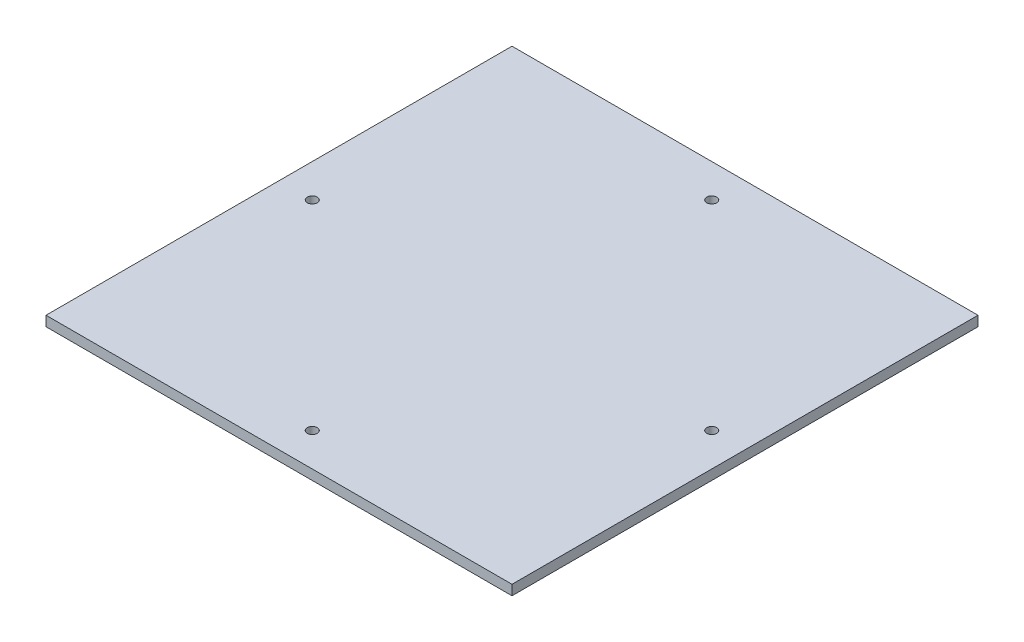
from build123d import *

# Parameters (mm, degrees)
SKETCH_1_W          = 140
SKETCH_1_H          = 140
EXTRUDE_1_DEPTH     = 3
SKETCH_2_R          = 1.5
CUT_EXTRUDE_1_DEPTH = 100.040395799


with BuildPart() as part:
    # 草图1 → 凸台-拉伸1 (new body)
    with BuildSketch(Plane(origin=(0, 0, 0), x_dir=(1, 0, 0), z_dir=(0, 1, 0))):
        Rectangle(SKETCH_1_W, SKETCH_1_H)
    extrude(amount=EXTRUDE_1_DEPTH)

    # 草图2 → 切除-拉伸1 (cut, through all)
    with BuildSketch(Plane(origin=(0, 3, 0), x_dir=(1, 0, 0), z_dir=(0, 1, 0))):
        with Locations(Location((0, 60, 0), (0, 0, 270))):
            Circle(SKETCH_2_R)
        with Locations(Location((60, 0, 0), (0, 0, 270))):
            Circle(SKETCH_2_R)
        with Locations(Location((0, -60, 0), (0, 0, 270))):
            Circle(SKETCH_2_R)
        with Locations(Location((-60, 0, 0), (0, 0, 270))):
            Circle(SKETCH_2_R)
    extrude(amount=-CUT_EXTRUDE_1_DEPTH, mode=Mode.SUBTRACT)


solid = part.part
